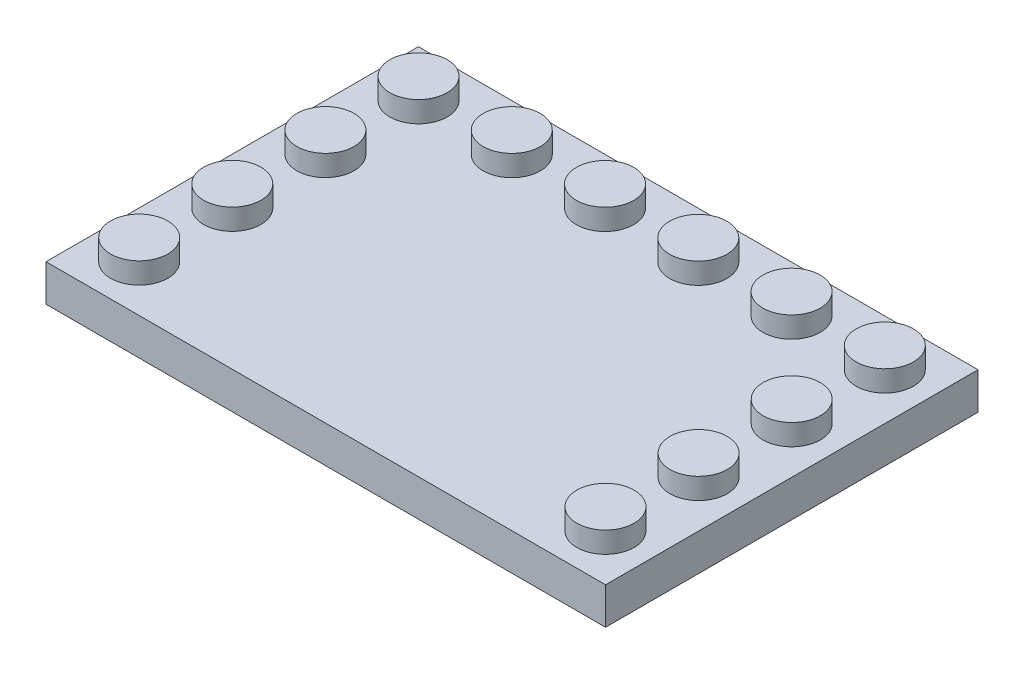
from build123d import *

# Parameters (mm, degrees)
SKETCH1_W           = 47.85
SKETCH1_H           = 31.85
BOSS_EXTRUDE1_DEPTH = 3.15
SKETCH2_R           = 2.45
BOSS_EXTRUDE2_DEPTH = 1.8
SHELL1_T            = -1.5
SKETCH3_R           = 3.25
SKETCH3_R_2         = 2.35
BOSS_EXTRUDE3_DEPTH = 1.45


with BuildPart() as part:
    # Sketch1 → Boss-Extrude1 (new body)
    with BuildSketch(Plane(origin=(0, 0, 0), x_dir=(1, 0, 0), z_dir=(0, 1, 0))):
        Rectangle(SKETCH1_W, SKETCH1_H)
    extrude(amount=-BOSS_EXTRUDE1_DEPTH)

    # Sketch2 → Boss-Extrude2 (add)
    with BuildSketch(Plane(origin=(0, 0, 0), x_dir=(1, 0, 0), z_dir=(0, 1, 0))):
        with Locations(Location((-19.9375, -11.94375, 0), (0, 0, 270))):
            Circle(SKETCH2_R)
        with Locations(Location((-19.9375, -3.98125, 0), (0, 0, 270))):
            Circle(SKETCH2_R)
        with Locations(Location((-19.9375, 3.98125, 0), (0, 0, 270))):
            Circle(SKETCH2_R)
        with Locations(Location((-19.9375, 11.94375, 0), (0, 0, 270))):
            Circle(SKETCH2_R)
        with Locations(Location((-11.9625, 11.94375, 0), (0, 0, 270))):
            Circle(SKETCH2_R)
        with Locations(Location((-3.9875, 11.94375, 0), (0, 0, 270))):
            Circle(SKETCH2_R)
        with Locations(Location((3.9875, 11.94375, 0), (0, 0, 270))):
            Circle(SKETCH2_R)
        with Locations(Location((11.9625, 11.94375, 0), (0, 0, 270))):
            Circle(SKETCH2_R)
        with Locations(Location((19.9375, 11.94375, 0), (0, 0, 270))):
            Circle(SKETCH2_R)
        with Locations(Location((19.9375, 3.98125, 0), (0, 0, 270))):
            Circle(SKETCH2_R)
        with Locations(Location((19.9375, -3.98125, 0), (0, 0, 270))):
            Circle(SKETCH2_R)
        with Locations(Location((19.9375, -11.94375, 0), (0, 0, 270))):
            Circle(SKETCH2_R)
    extrude(amount=BOSS_EXTRUDE2_DEPTH)

    # Shell1
    shell1_openings = [part.faces().sort_by_distance(p)[0] for p in [
        (0, -3.15, 0),
    ]]
    offset(amount=SHELL1_T, openings=shell1_openings, kind=Kind.INTERSECTION)

    # Sketch3 → Boss-Extrude3 (add)
    # profile 1 of 15: a face of its own
    with BuildSketch(Plane.XZ.offset(1.5)):
        with Locations(Location((-15.95, -7.9625, 0), (0, 0, 90))):
            Circle(SKETCH3_R)
        with Locations(Location((-15.95, -7.9625, 0), (0, 0, 90))):
            Circle(SKETCH3_R_2, mode=Mode.SUBTRACT)
    # profile 2 of 15: a face of its own
    with BuildSketch(Plane.XZ.offset(1.5)):
        with Locations(Location((-7.975, -7.9625, 0), (0, 0, 90))):
            Circle(SKETCH3_R)
        with Locations(Location((-7.975, -7.9625, 0), (0, 0, 90))):
            Circle(SKETCH3_R_2, mode=Mode.SUBTRACT)
    # profile 3 of 15: a face of its own
    with BuildSketch(Plane.XZ.offset(1.5)):
        with Locations(Location((0, -7.9625, 0), (0, 0, 90))):
            Circle(SKETCH3_R)
        with Locations(Location((0, -7.9625, 0), (0, 0, 90))):
            Circle(SKETCH3_R_2, mode=Mode.SUBTRACT)
    # profile 4 of 15: a face of its own
    with BuildSketch(Plane.XZ.offset(1.5)):
        with Locations(Location((7.975, -7.9625, 0), (0, 0, 90))):
            Circle(SKETCH3_R)
        with Locations(Location((7.975, -7.9625, 0), (0, 0, 90))):
            Circle(SKETCH3_R_2, mode=Mode.SUBTRACT)
    # profile 5 of 15: a face of its own
    with BuildSketch(Plane.XZ.offset(1.5)):
        with Locations(Location((15.95, -7.9625, 0), (0, 0, 90))):
            Circle(SKETCH3_R)
        with Locations(Location((15.95, -7.9625, 0), (0, 0, 90))):
            Circle(SKETCH3_R_2, mode=Mode.SUBTRACT)
    # profile 6 of 15: a face of its own
    with BuildSketch(Plane.XZ.offset(1.5)):
        with Locations(Location((-7.975, 0, 0), (0, 0, 90))):
            Circle(SKETCH3_R)
        with Locations(Location((-7.975, 0, 0), (0, 0, 90))):
            Circle(SKETCH3_R_2, mode=Mode.SUBTRACT)
    # profile 7 of 15: a face of its own
    with BuildSketch(Plane.XZ.offset(1.5)):
        with Locations(Location((0, 0, 0), (0, 0, 90))):
            Circle(SKETCH3_R)
        with Locations(Location((0, 0, 0), (0, 0, 90))):
            Circle(SKETCH3_R_2, mode=Mode.SUBTRACT)
    # profile 8 of 15: a face of its own
    with BuildSketch(Plane.XZ.offset(1.5)):
        with Locations(Location((7.975, 0, 0), (0, 0, 90))):
            Circle(SKETCH3_R)
        with Locations(Location((7.975, 0, 0), (0, 0, 90))):
            Circle(SKETCH3_R_2, mode=Mode.SUBTRACT)
    # profile 9 of 15: a face of its own
    with BuildSketch(Plane.XZ.offset(1.5)):
        with Locations(Location((15.95, 0, 0), (0, 0, 90))):
            Circle(SKETCH3_R)
        with Locations(Location((15.95, 0, 0), (0, 0, 90))):
            Circle(SKETCH3_R_2, mode=Mode.SUBTRACT)
    # profile 10 of 15: a face of its own
    with BuildSketch(Plane.XZ.offset(1.5)):
        with Locations(Location((-7.975, 7.9625, 0), (0, 0, 90))):
            Circle(SKETCH3_R)
        with Locations(Location((-7.975, 7.9625, 0), (0, 0, 90))):
            Circle(SKETCH3_R_2, mode=Mode.SUBTRACT)
    # profile 11 of 15: a face of its own
    with BuildSketch(Plane.XZ.offset(1.5)):
        with Locations(Location((0, 7.9625, 0), (0, 0, 90))):
            Circle(SKETCH3_R)
        with Locations(Location((0, 7.9625, 0), (0, 0, 90))):
            Circle(SKETCH3_R_2, mode=Mode.SUBTRACT)
    # profile 12 of 15: a face of its own
    with BuildSketch(Plane.XZ.offset(1.5)):
        with Locations(Location((7.975, 7.9625, 0), (0, 0, 90))):
            Circle(SKETCH3_R)
        with Locations(Location((7.975, 7.9625, 0), (0, 0, 90))):
            Circle(SKETCH3_R_2, mode=Mode.SUBTRACT)
    # profile 13 of 15: a face of its own
    with BuildSketch(Plane.XZ.offset(1.5)):
        with Locations(Location((15.95, 7.9625, 0), (0, 0, 90))):
            Circle(SKETCH3_R)
        with Locations(Location((15.95, 7.9625, 0), (0, 0, 90))):
            Circle(SKETCH3_R_2, mode=Mode.SUBTRACT)
    # profile 14 of 15: a face of its own
    with BuildSketch(Plane.XZ.offset(1.5)):
        with Locations(Location((-15.95, 0, 0), (0, 0, 90))):
            Circle(SKETCH3_R)
        with Locations(Location((-15.95, 0, 0), (0, 0, 90))):
            Circle(SKETCH3_R_2, mode=Mode.SUBTRACT)
    # profile 15 of 15: a face of its own
    with BuildSketch(Plane.XZ.offset(1.5)):
        with Locations(Location((-15.95, 7.9625, 0), (0, 0, 90))):
            Circle(SKETCH3_R)
        with Locations(Location((-15.95, 7.9625, 0), (0, 0, 90))):
            Circle(SKETCH3_R_2, mode=Mode.SUBTRACT)
    extrude(amount=BOSS_EXTRUDE3_DEPTH)


solid = part.part
